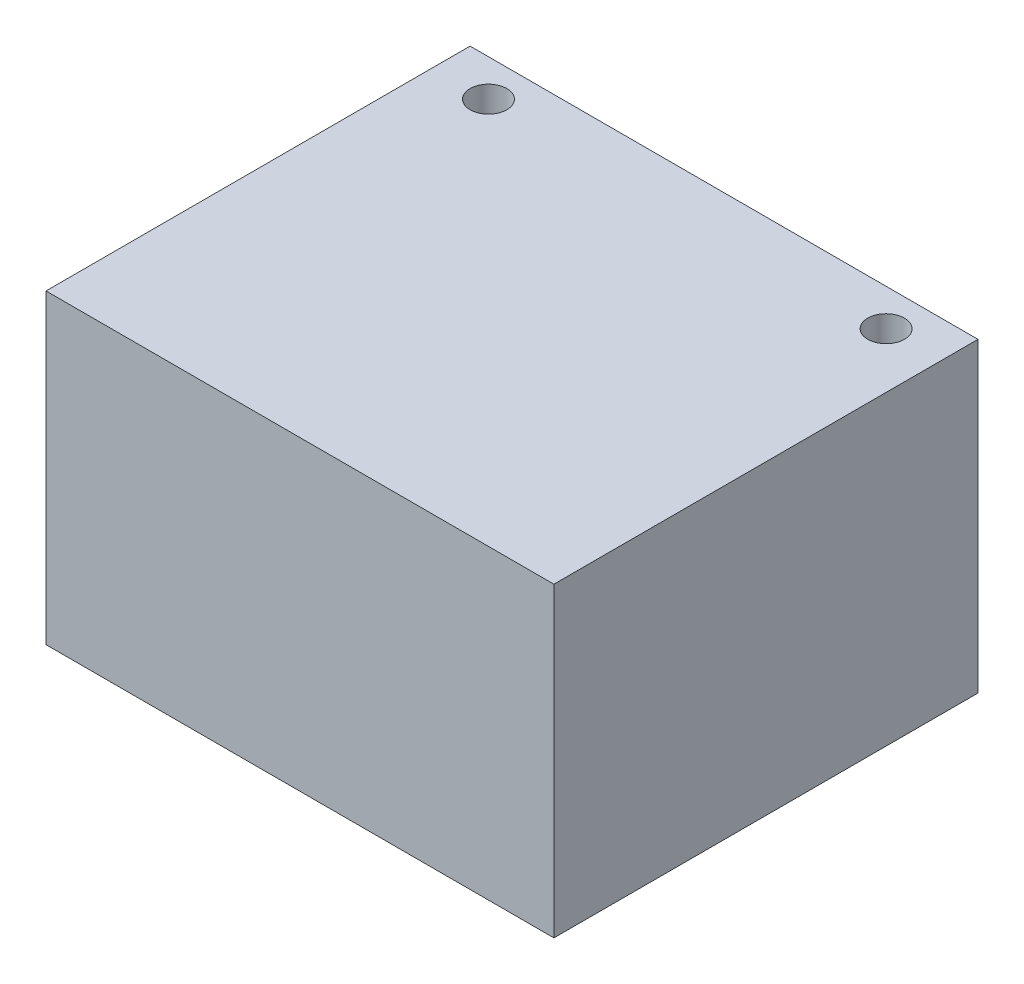
from build123d import *

# Parameters (mm, degrees)
SKETCH1_W           = 41.45
SKETCH1_H           = 34.61
BOSS_EXTRUDE1_DEPTH = 25
SKETCH2_R           = 1.5
CUT_EXTRUDE1_DEPTH  = 25


with BuildPart() as part:
    # Sketch1 → Boss-Extrude1 (new body)
    with BuildSketch(Plane(origin=(0, 0, 0), x_dir=(1, 0, 0), z_dir=(0, 1, 0))):
        Rectangle(SKETCH1_W, SKETCH1_H)
    extrude(amount=BOSS_EXTRUDE1_DEPTH)

    # Sketch2 → Cut-Extrude1 (cut)
    with BuildSketch(Plane(origin=(0, 25, 0), x_dir=(1, 0, 0), z_dir=(0, 1, 0))):
        with Locations(Location((-16.225, 14.305, 0), (0, 0, 270))):
            Circle(SKETCH2_R)
        with Locations(Location((16.225, 14.305, 0), (0, 0, 270))):
            Circle(SKETCH2_R)
    extrude(amount=-CUT_EXTRUDE1_DEPTH, mode=Mode.SUBTRACT)


solid = part.part
